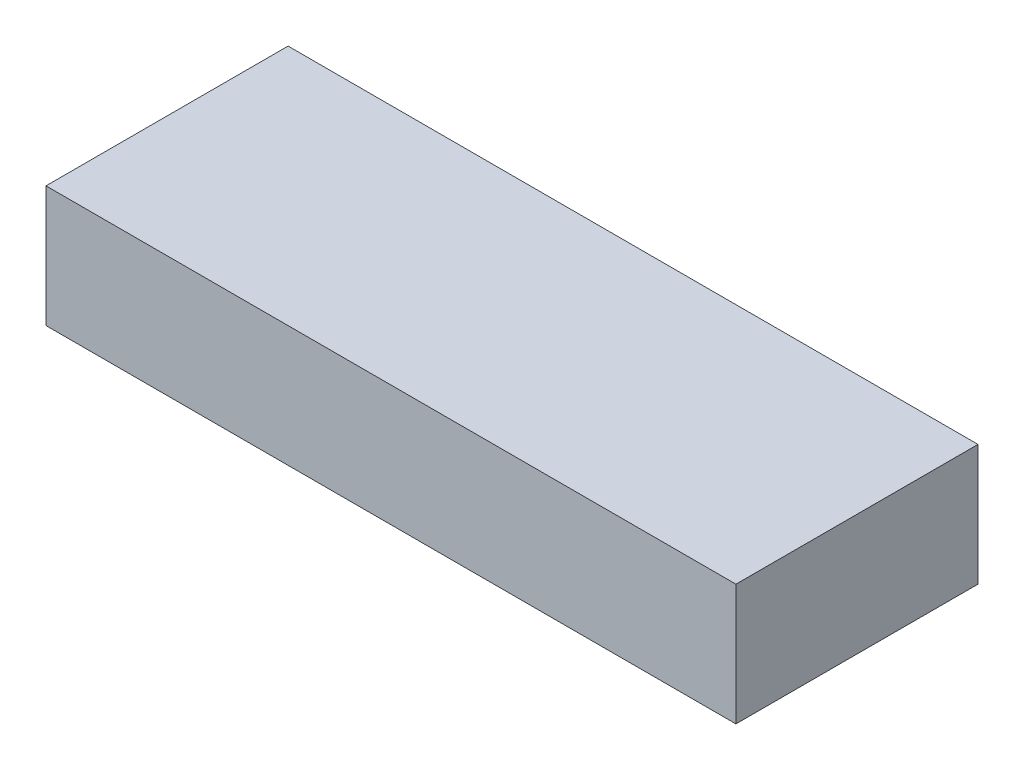
from build123d import *

# Parameters (mm, degrees)
SKETCH1_W           = 57
SKETCH1_H           = 20
BOSS_EXTRUDE1_DEPTH = 10


with BuildPart() as part:
    # Sketch1 → Boss-Extrude1 (new body)
    with BuildSketch(Plane(origin=(0, 0, 0), x_dir=(1, 0, 0), z_dir=(0, 1, 0))):
        with Locations((28.5, 10)):
            Rectangle(SKETCH1_W, SKETCH1_H)
    extrude(amount=BOSS_EXTRUDE1_DEPTH)


solid = part.part
